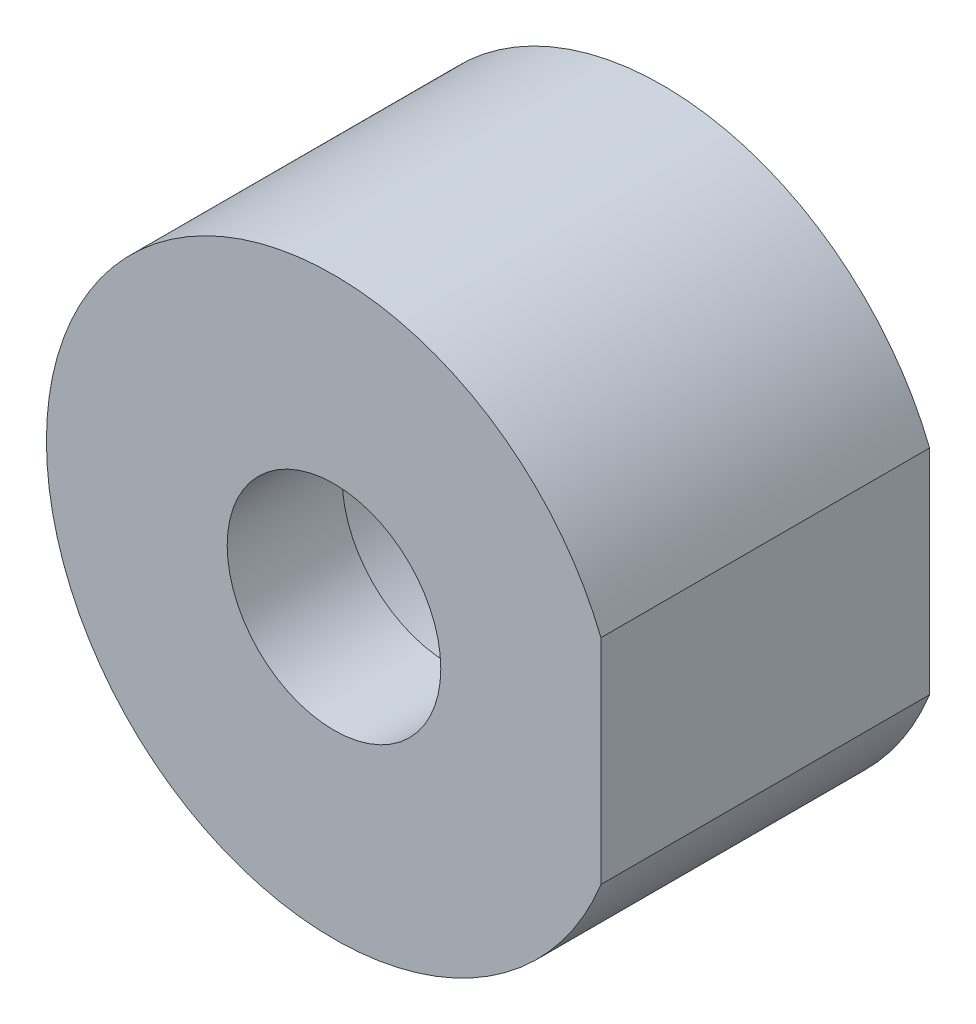
from build123d import *

# Parameters (mm, degrees)
EXTRUDE_1_DEPTH     = 8
SKETCH_2_R          = 3.95
CUT_EXTRUDE_1_DEPTH = 5.2
SKETCH_3_R          = 2.6
CUT_EXTRUDE_2_DEPTH = 5.2


with BuildPart() as part:
    # Эскиз1 → Бобышка-Вытянуть1 (new body)
    with BuildSketch(Plane.XY):
        with BuildLine():
            Line((6.498674865, -2.601389052), (6.498674865, 2.601389052))
            ThreePointArc((6.498674865, 2.601389052), (-7, 0), (6.498674865, -2.601389052))
        make_face()
    extrude(amount=EXTRUDE_1_DEPTH)

    # Эскиз2 → Вырез-Вытянуть1 (cut)
    with BuildSketch(Plane(origin=(0, 0, 0), x_dir=(-1, 0, 0), z_dir=(0, 0, -1))):
        Circle(SKETCH_2_R)
    extrude(amount=-CUT_EXTRUDE_1_DEPTH, mode=Mode.SUBTRACT)

    # Эскиз3 → Вырез-Вытянуть2 (cut)
    with BuildSketch(Plane(origin=(0, 0, 5.2), x_dir=(-1, 0, 0), z_dir=(0, 0, -1))):
        Circle(SKETCH_3_R)
    extrude(amount=-CUT_EXTRUDE_2_DEPTH, mode=Mode.SUBTRACT)


solid = part.part
